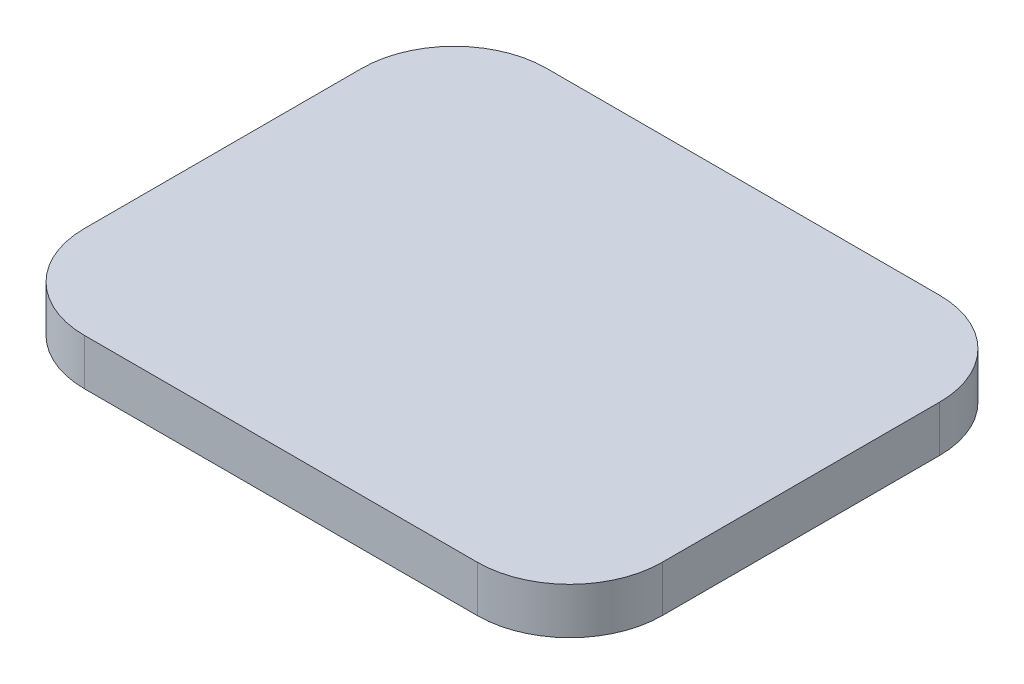
from build123d import *

# Parameters (mm, degrees)
SKETCH1_W           = 25
SKETCH1_H           = 20
BOSS_EXTRUDE1_DEPTH = 2
FILLET1_R           = 4


with BuildPart() as part:
    # Sketch1 → Boss-Extrude1 (new body)
    with BuildSketch(Plane(origin=(0, 0, 0), x_dir=(1, 0, 0), z_dir=(0, 1, 0))):
        Rectangle(SKETCH1_W, SKETCH1_H)
    extrude(amount=BOSS_EXTRUDE1_DEPTH)

    # Fillet1
    fillet1_edges = [part.edges().sort_by_distance(p)[0] for p in [
        (12.5, 1, 10),
        (-12.5, 1, 10),
        (-12.5, 1, -10),
        (12.5, 1, -10),
    ]]
    fillet(fillet1_edges, radius=FILLET1_R)


solid = part.part
